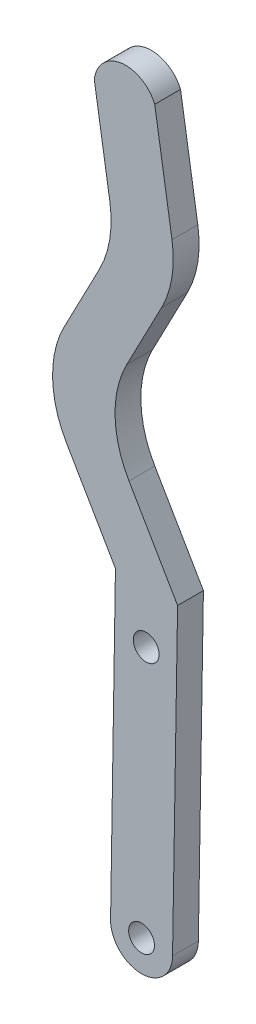
from build123d import *

# Parameters (mm, degrees)
SKETCH_1_R      = 2.5
EXTRUDE_1_DEPTH = 5


with BuildPart() as part:
    # Эскиз1 → Вытянуть1 (new body)
    with BuildSketch(Plane.XY):
        with BuildLine():
            Line((-5.996779713, 0.196552972), (-5.056999721, 59.443873761))
            Line((-5.056999721, 59.443873761), (-14.520173102, 75.715501286))
            ThreePointArc((-14.520173102, 75.715501286), (-17.226120819, 85.311611147), (-14.963001631, 95.021697091))
            Line((-14.963001631, 95.021697091), (-8.160722176, 108.059141137))
            ThreePointArc((-8.160722176, 108.059141137), (-6.152874831, 114.092941719), (-6.140599008, 120.452033615))
            Line((-6.140599008, 120.452033615), (-9.157402478, 139.420199329))
            ThreePointArc((-9.157402478, 139.420199329), (-3.940932329, 144.75283841), (2.549919095, 141.076230168))
            Line((2.549919095, 141.076230168), (5.89519306, 120.042804706))
            ThreePointArc((5.89519306, 120.042804706), (5.882917236, 113.68371281), (3.875069891, 107.649912228))
            Line((3.875069891, 107.649912228), (-2.87016044, 94.721810171))
            ThreePointArc((-2.87016044, 94.721810171), (-5.133279628, 85.011724227), (-2.42733191, 75.415614366))
            Line((-2.42733191, 75.415614366), (6.976825569, 59.245462816))
            Line((6.976825569, 59.245462816), (6, 0))
            ThreePointArc((6, 0), (-0.098289675, -5.999194874), (-5.996779713, 0.196552972))
        make_face()
        Circle(SKETCH_1_R, mode=Mode.SUBTRACT)
        with Locations((0.896058218, 49.222155117)):
            Circle(SKETCH_1_R, mode=Mode.SUBTRACT)
    extrude(amount=EXTRUDE_1_DEPTH)


solid = part.part
